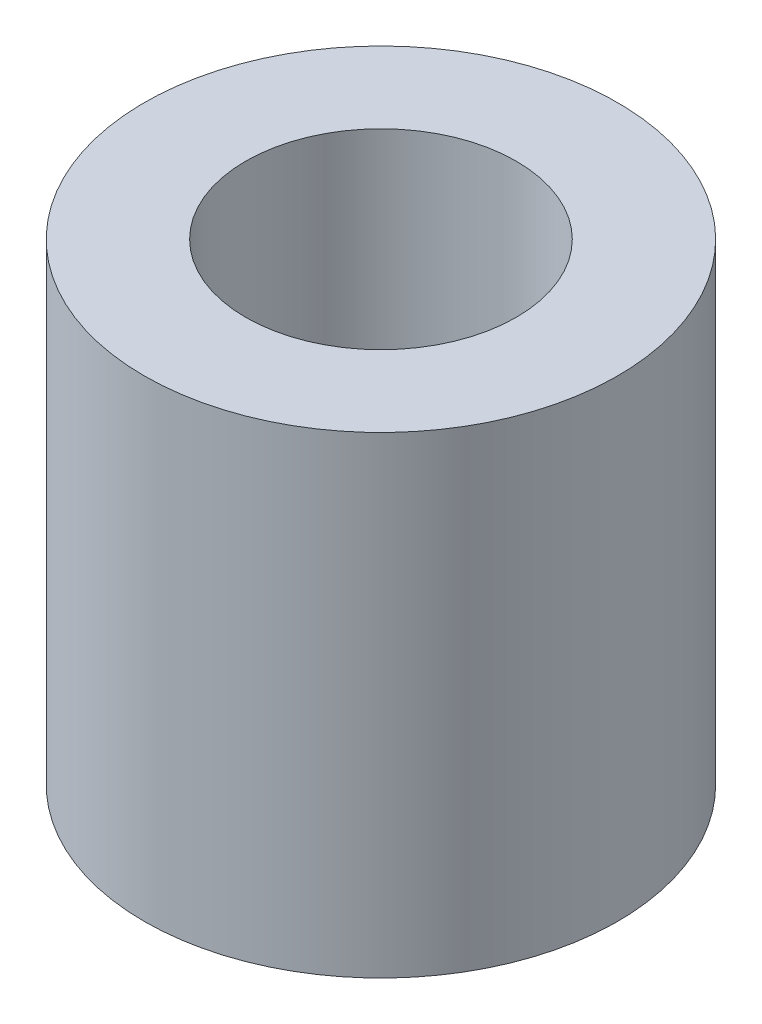
from build123d import *

# Parameters (mm, degrees)
SKETCH2_R           = 5.335
SKETCH2_R_2         = 3.05
BOSS_EXTRUDE1_DEPTH = 10.65


with BuildPart() as part:
    # Sketch2 → Boss-Extrude1 (new body)
    with BuildSketch(Plane(origin=(0, 0, 0), x_dir=(1, 0, 0), z_dir=(0, 1, 0))):
        with Locations(Location((0, 0, 0), (0, 0, 270))):
            Circle(SKETCH2_R)
        with Locations(Location((0, 0, 0), (0, 0, 270))):
            Circle(SKETCH2_R_2, mode=Mode.SUBTRACT)
    extrude(amount=BOSS_EXTRUDE1_DEPTH)


solid = part.part
